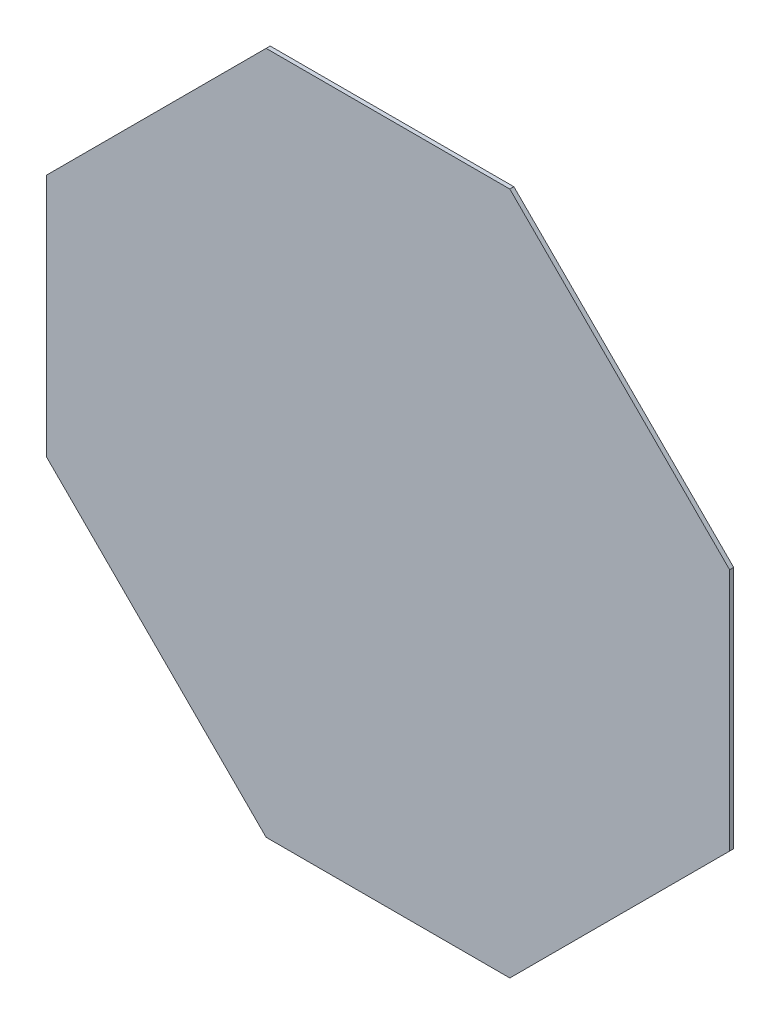
from build123d import *

# Parameters (mm, degrees)
BOSS_EXTRUDE1_DEPTH = 3


with BuildPart() as part:
    # Sketch1 → Boss-Extrude1 (new body)
    with BuildSketch(Plane.XY):
        Polygon((164, -159.757359313), (1.242640687, 3), (-179.242640687, 3), (-342, -159.757359313), (-342, -340.242640687), (-179.242640687, -503), (1.242640687, -503), (164, -340.242640687), align=None)
    extrude(amount=BOSS_EXTRUDE1_DEPTH)


solid = part.part
